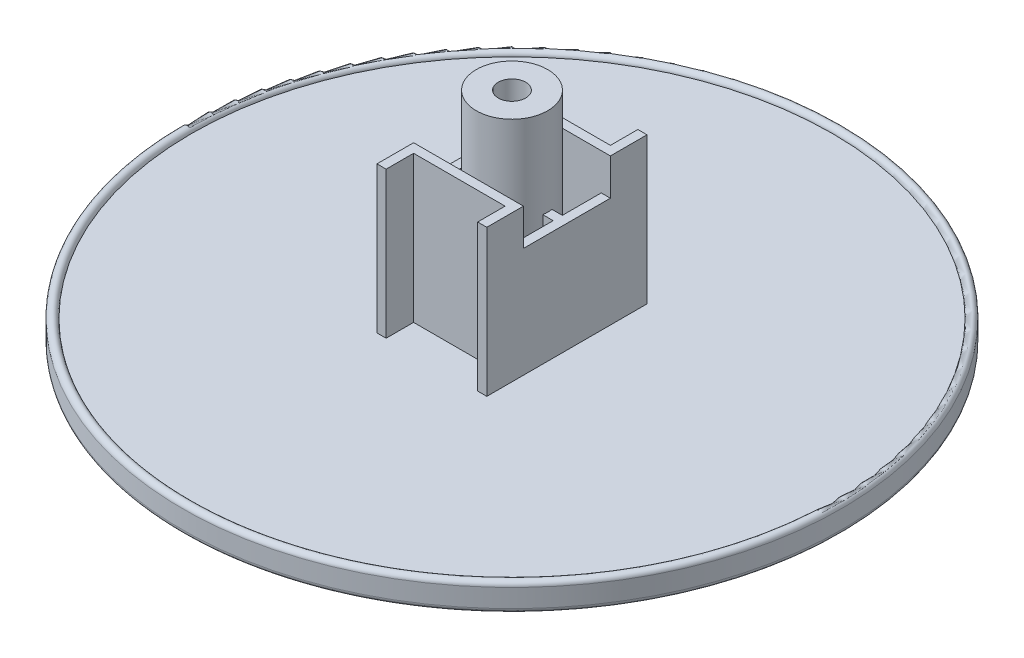
from build123d import *

# Parameters (mm, degrees)
SKETCH_3_W      = 2.4
SKETCH_3_H      = 21.6
SKETCH_4_W      = 1
SKETCH_4_H      = 3
EXTRUDE_1_DEPTH = 16
EXTRUDE_START   = 12
EXTRUDE_2_DEPTH = 12


with BuildPart() as part:
    # 草图3 → 旋转2 (revolve)
    with BuildSketch(Plane.XY, mode=Mode.PRIVATE) as revolve_2_sk:
        with Locations((2.7, 12.8)):
            Rectangle(SKETCH_3_W, SKETCH_3_H)
        Polygon((0, 2), (0, 0), (35, 0), (35, 2), (3.9, 2), (1.5, 2), align=None)
        with BuildLine():
            ThreePointArc((36, 2), (35.5, 2.5), (35, 2))
            Line((35, 2), (36, 2))
        make_face()
        with BuildLine():
            Line((36, 2), (35, 2))
            ThreePointArc((35, 2), (35.5, 1.5), (36, 2))
        make_face()
        with BuildLine():
            ThreePointArc((36, 2), (35.5, 2.5), (35, 2))
            Line((35, 2), (36, 2))
        make_face()
        with BuildLine():
            Line((36, 2), (35, 2))
            ThreePointArc((35, 2), (35.5, 1.5), (36, 2))
        make_face()
        with BuildLine():
            Line((35, 2), (35, 0))
            ThreePointArc((35, 0), (35.5, 0.5), (36, 0))
            Line((36, 0), (36, 2))
            ThreePointArc((36, 2), (35.5, 1.5), (35, 2))
        make_face()
        with BuildLine():
            ThreePointArc((36, 0), (35.5, 0.5), (35, 0))
            Line((35, 0), (36, 0))
        make_face()
        with BuildLine():
            Line((36, 0), (35, 0))
            ThreePointArc((35, 0), (35.5, -0.5), (36, 0))
        make_face()
        with BuildLine():
            ThreePointArc((36, 0), (35.5, 0.5), (35, 0))
            Line((35, 0), (36, 0))
        make_face()
        with BuildLine():
            Line((36, 0), (35, 0))
            ThreePointArc((35, 0), (35.5, -0.5), (36, 0))
        make_face()
    revolve(revolve_2_sk.sketch.rotate(Axis((0, 2, 0), (0, 1, 0)), 90), axis=Axis((0, 2, 0), (0, 1, 0)))

    # 草图4 → 凸台-拉伸1 (add)
    with BuildSketch(Plane(origin=(0, 2, 0), x_dir=(1, 0, 0), z_dir=(0, 1, 0))):
        with Locations((-5.5, 7.25)):
            Rectangle(SKETCH_4_W, SKETCH_4_H)
        Polygon((-6, 4.75), (-5, 4.75), (5, 4.75), (6, 4.75), (6, 5.75), (5, 5.75), (-5, 5.75), (-6, 5.75), align=None)
        with Locations((5.5, 7.25)):
            Rectangle(SKETCH_4_W, SKETCH_4_H)
        Polygon((5, -4.75), (-5, -4.75), (-6, -4.75), (-6, -5.75), (-5, -5.75), (5, -5.75), (6, -5.75), (6, -4.75), align=None)
        with Locations((-5.5, -7.25)):
            Rectangle(SKETCH_4_W, SKETCH_4_H)
        with Locations((5.5, -7.25)):
            Rectangle(SKETCH_4_W, SKETCH_4_H)
    extrude(amount=EXTRUDE_1_DEPTH)

    # 草图6 → 凸台-拉伸2 (add)
    with BuildSketch(Plane(origin=(0, 2, 0), x_dir=(1, 0, 0), z_dir=(0, 1, 0)).offset(EXTRUDE_START)):
        Polygon((-5, -0.5), (-5, 0.5), (-5, 4.75), (-6, 4.75), (-6, -4.75), (-5, -4.75), align=None)
        with BuildLine():
            ThreePointArc((0.5, -3.867815921), (0, -3.9), (-0.5, -3.867815921))
            Line((-0.5, -3.867815921), (-0.5, -4.75))
            Line((-0.5, -4.75), (0.5, -4.75))
            Line((0.5, -4.75), (0.5, -3.867815921))
        make_face()
        with BuildLine():
            Line((-0.5, 4.75), (-0.5, 3.867815921))
            ThreePointArc((-0.5, 3.867815921), (0, 3.9), (0.5, 3.867815921))
            Line((0.5, 3.867815921), (0.5, 4.75))
            Line((0.5, 4.75), (-0.5, 4.75))
        make_face()
        with BuildLine():
            ThreePointArc((-3.867815921, -0.5), (-3.9, 0), (-3.867815921, 0.5))
            Line((-3.867815921, 0.5), (-5, 0.5))
            Line((-5, 0.5), (-5, -0.5))
            Line((-5, -0.5), (-3.867815921, -0.5))
        make_face()
        with BuildLine():
            Line((5, 0.5), (3.867815921, 0.5))
            ThreePointArc((3.867815921, 0.5), (3.891945663, 0.250517372), (3.9, 0))
            ThreePointArc((3.9, 0), (3.891945663, -0.250517372), (3.867815921, -0.5))
            Line((3.867815921, -0.5), (5, -0.5))
            Line((5, -0.5), (5, 0.5))
        make_face()
        Polygon((6, 4.75), (5, 4.75), (5, 0.5), (5, -0.5), (5, -4.75), (6, -4.75), align=None)
    extrude(amount=-EXTRUDE_2_DEPTH)


solid = part.part
